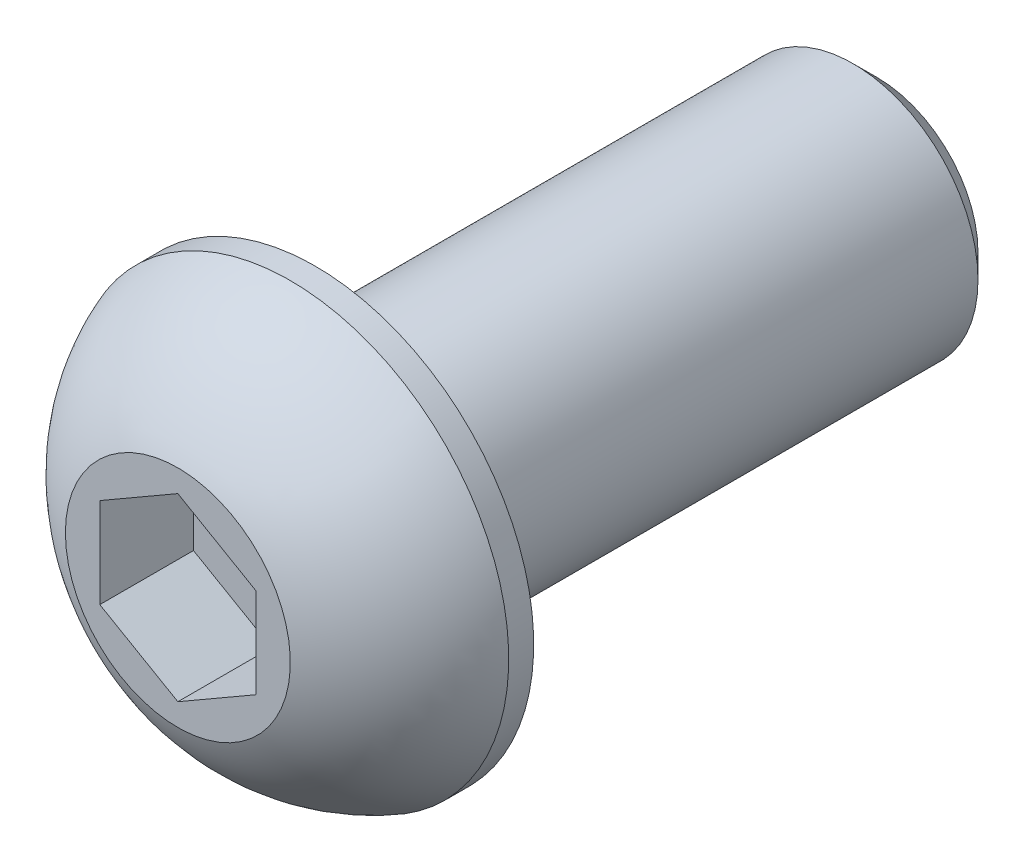
from build123d import *

# Parameters (mm, degrees)
SKETCH2_R           = 4
BOSS_EXTRUDE1_DEPTH = 18
CUT_EXTRUDE1_DEPTH  = 3
CHAMFER1_SIZE       = 0.7668
FILLET1_R           = 0.4


with BuildPart() as part:
    # Sketch1 → Revolve1 (revolve)
    with BuildSketch(Plane.XZ, mode=Mode.PRIVATE) as revolve1_sk:
        with BuildLine():
            Line((3.603028, 4.4), (0, 4.4))
            Line((0, 4.4), (0, 0))
            Line((0, 0), (7, 0))
            Line((7, 0), (7, 0.8))
            ThreePointArc((7, 0.8), (5.673259557, 2.950780347), (3.603028, 4.4))
        make_face()
    revolve(revolve1_sk.sketch.rotate(Axis((0, 0, 4.4), (0, 0, -1)), 180), axis=Axis((0, 0, 4.4), (0, 0, -1)))

    # Sketch2 → Boss-Extrude1 (add)
    with BuildSketch(Plane(origin=(0, 0, 0), x_dir=(-1, 0, 0), z_dir=(0, 0, -1))):
        Circle(SKETCH2_R)
    extrude(amount=BOSS_EXTRUDE1_DEPTH)

    # Sketch3 → Cut-Extrude1 (cut)
    with BuildSketch(Plane.XY.offset(4.4)):
        Polygon((2.5, -1.443375673), (2.5, 1.443375673), (0, 2.886751346), (-2.5, 1.443375673), (-2.5, -1.443375673), (0, -2.886751346), align=None)
    extrude(amount=-CUT_EXTRUDE1_DEPTH, mode=Mode.SUBTRACT)

    # Chamfer1
    chamfer1_edges = [part.edges().sort_by_distance(p)[0] for p in [
        (4, 0, -18),
    ]]
    chamfer(chamfer1_edges, length=CHAMFER1_SIZE)

    # Fillet1
    fillet1_edges = [part.edges().sort_by_distance(p)[0] for p in [
        (4, 0, 0),
    ]]
    fillet(fillet1_edges, radius=FILLET1_R)


solid = part.part
